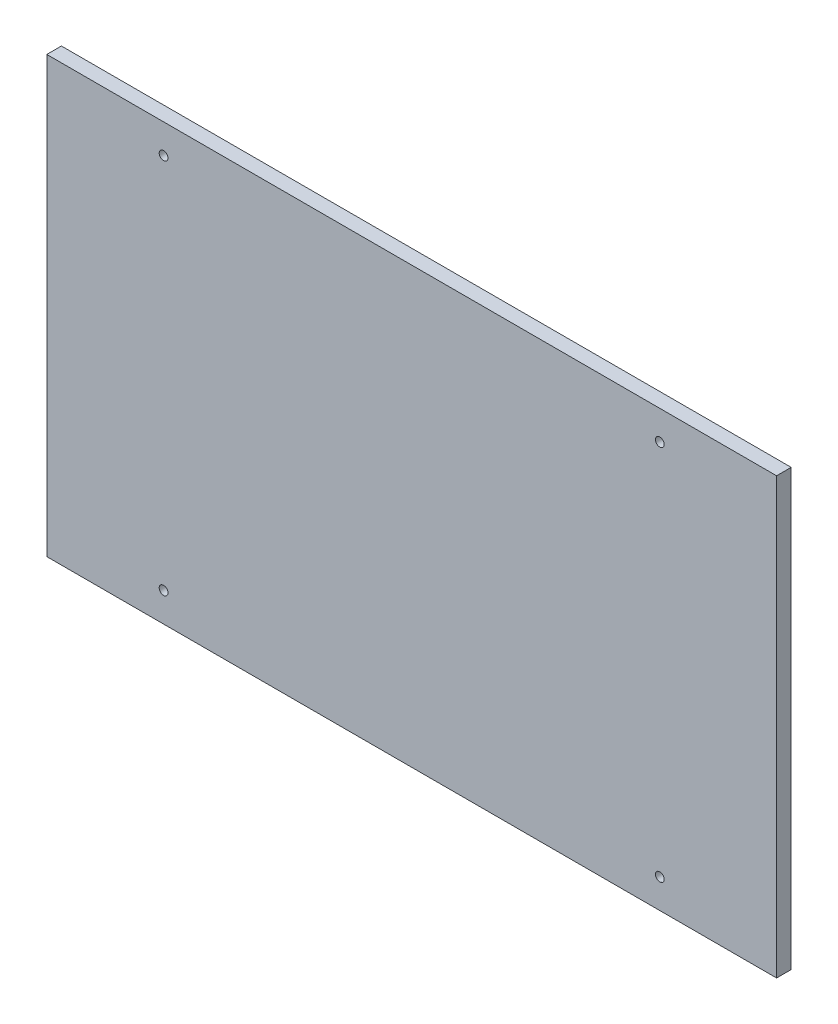
from build123d import *

# Parameters (mm, degrees)
ESQUISSE1_W             = 250
ESQUISSE1_H             = 149
BOSS_EXTRU_1_DEPTH      = 5
ESQUISSE2_R             = 1.5
ENL_V_MAT_EXTRU_2_DEPTH = 5


with BuildPart() as part:
    # Esquisse1 → Boss.-Extru.1 (new body)
    with BuildSketch(Plane.XY):
        Rectangle(ESQUISSE1_W, ESQUISSE1_H)
    extrude(amount=BOSS_EXTRU_1_DEPTH)

    # Esquisse2 → Enlèv. mat.-Extru.2 (cut)
    with BuildSketch(Plane.XY.offset(5)):
        with Locations((-85, 64.5)):
            Circle(ESQUISSE2_R)
        with Locations(Location((-85, -64.5, 0), (0, 0, 180))):
            Circle(ESQUISSE2_R)
        with Locations((85, -64.5)):
            Circle(ESQUISSE2_R)
        with Locations(Location((85, 64.5, 0), (0, 0, 180))):
            Circle(ESQUISSE2_R)
    extrude(amount=-ENL_V_MAT_EXTRU_2_DEPTH, mode=Mode.SUBTRACT)


solid = part.part
